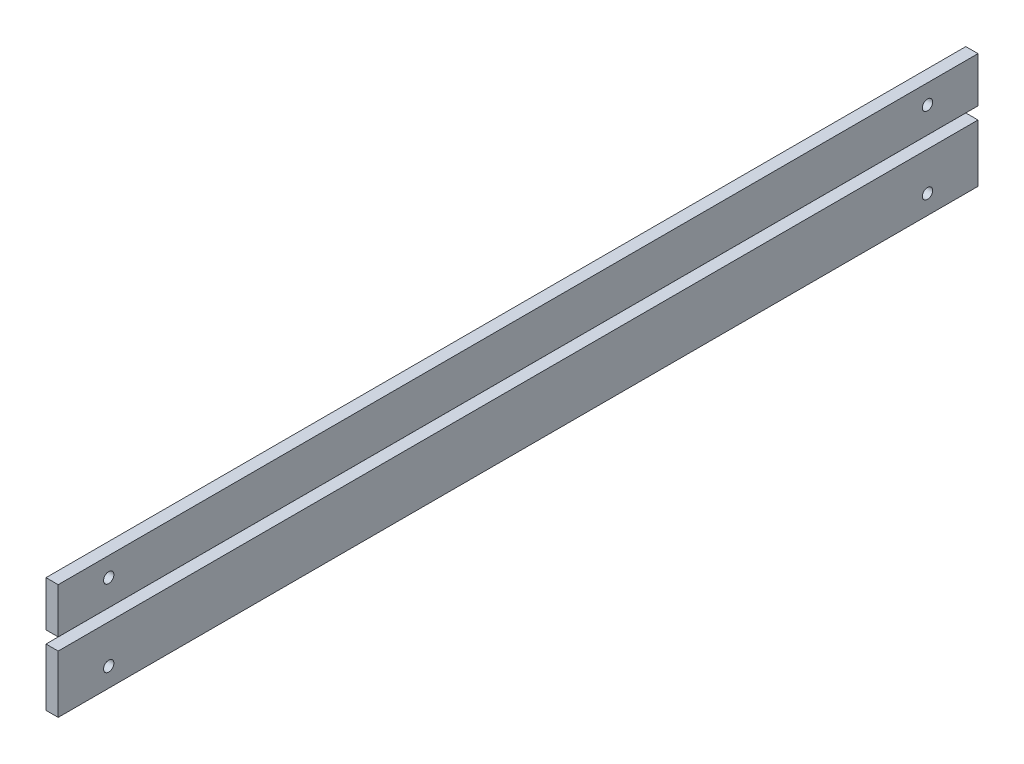
from build123d import *

# Parameters (mm, degrees)
SKETCH1_W               = 240
SKETCH1_H               = 30
BOSS_EXTRUDE1_DEPTH     = 3.18
CUT_EXTRUDE1_REACH      = 122.976
SKETCH2_R               = 1.35
MIRROR2_COPY_1_REACH    = 122.976
MIRROR2_COPY_1_SKETCH_R = 1.35
SKETCH3_W               = 240
SKETCH3_H               = 3.19
CUT_EXTRUDE2_DEPTH      = 10


with BuildPart() as part:
    # Sketch1 → Boss-Extrude1 (new body)
    with BuildSketch(Plane(origin=(0, 0, 0), x_dir=(0, 0, -1), z_dir=(1, 0, 0))):
        Rectangle(SKETCH1_W, SKETCH1_H)
    extrude(amount=BOSS_EXTRUDE1_DEPTH)

    # Sketch2 → Cut-Extrude1 (cut, up to next)
    with BuildSketch(Plane.ZY, mode=Mode.PRIVATE) as cut_extrude1_sk1:
        with Locations((-106.82, 10)):
            Circle(SKETCH2_R)
    cut_extrude1_tool1 = extrude(cut_extrude1_sk1.sketch, amount=-CUT_EXTRUDE1_REACH, mode=Mode.PRIVATE) & part.part
    cut_extrude1 = cut_extrude1_tool1.solids().sort_by_distance((0, 10, -106.82))[0]
    add(cut_extrude1, mode=Mode.SUBTRACT)

    # Mirror1: Cut-Extrude1 across plane
    add(cut_extrude1.mirror(Plane.ZX), mode=Mode.SUBTRACT)

    # Mirror2: Cut-Extrude1 across plane
    add(cut_extrude1.mirror(Plane.XY), mode=Mode.SUBTRACT)

    # Mirror2 copy 1 sketch → Mirror2 copy 1 (cut, up to next)
    with BuildSketch(Plane(origin=(0, 0, 0), x_dir=(0, 0, -1), z_dir=(-1, 0, 0)), mode=Mode.PRIVATE) as mirror2_copy_1_sk1:
        with Locations((-106.82, 10)):
            Circle(MIRROR2_COPY_1_SKETCH_R)
    mirror2_copy_1_tool1 = extrude(mirror2_copy_1_sk1.sketch, amount=-MIRROR2_COPY_1_REACH, mode=Mode.PRIVATE) & part.part
    add(mirror2_copy_1_tool1.solids().sort_by_distance((0, -10, 106.82))[0], mode=Mode.SUBTRACT)

    # Sketch3 → Cut-Extrude2 (cut)
    with BuildSketch(Plane(origin=(3.18, 0, 0), x_dir=(0, 0, -1), z_dir=(1, 0, 0))):
        with Locations((0, 1.595)):
            Rectangle(SKETCH3_W, SKETCH3_H)
    extrude(amount=-CUT_EXTRUDE2_DEPTH, mode=Mode.SUBTRACT)


with BuildPart() as cut_extrude2_piece_1:
    # of the separate pieces the step leaves, piece 1, a body of its own (cut_extrude2_pieces)
    add(part.part.solids().sort_by_distance((0, -15, 120))[0])


with BuildPart() as cut_extrude2_piece_2:
    # of the separate pieces the step leaves, piece 2, a body of its own (cut_extrude2_pieces)
    add(part.part.solids().sort_by_distance((0, 15, 120))[0])


solid = Compound([cut_extrude2_piece_1.part, cut_extrude2_piece_2.part])
